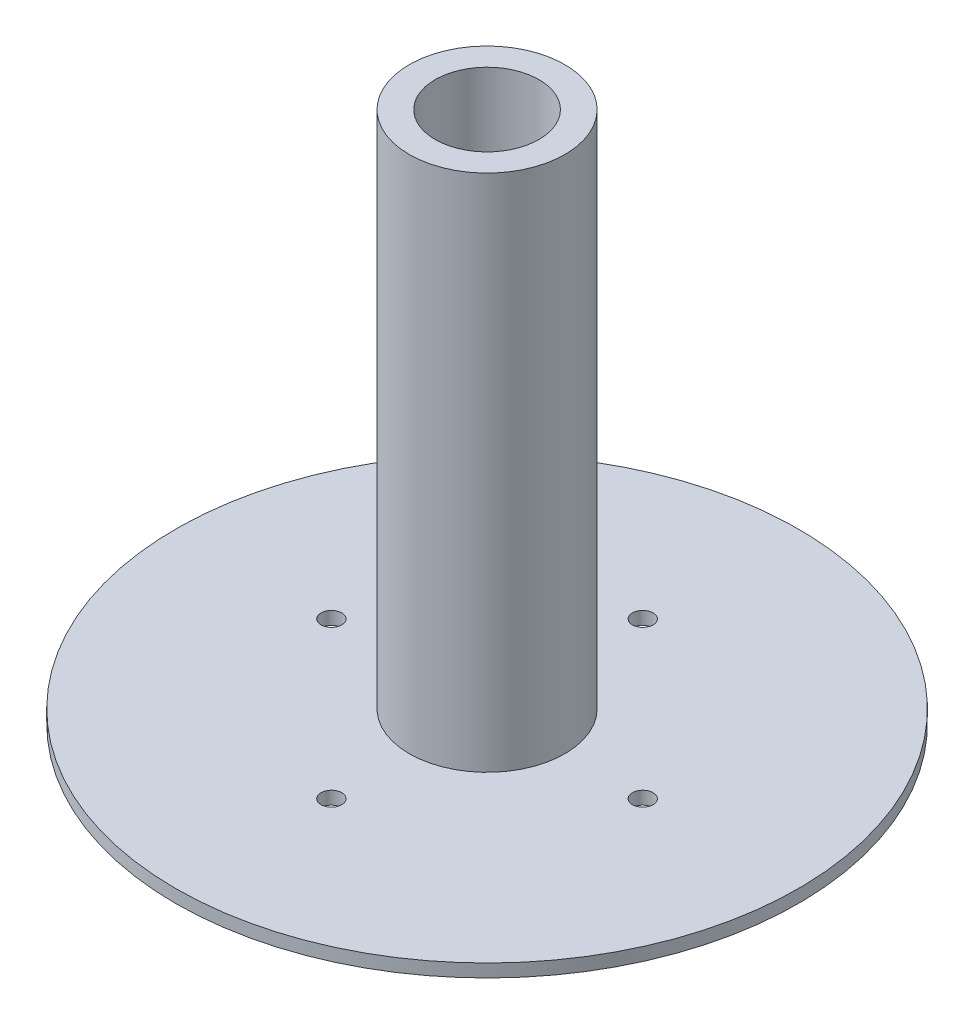
from build123d import *

# Parameters (mm, degrees)
SKETCH_1_R      = 120
EXTRUDE_1_DEPTH = 5
MM_2_D          = 8
MM_2_DEPTH      = 20
MM_2_TIP        = 2.403442476
SKETCH_6_R      = 30
SKETCH_6_R_2    = 20
EXTRUDE_2_DEPTH = 200


with BuildPart() as part:
    # 草图1 → 凸台-拉伸1 (new body)
    with BuildSketch(Plane(origin=(0, 0, 0), x_dir=(1, 0, 0), z_dir=(0, 1, 0))):
        with Locations(Location((0, 0, 0), (0, 0, 270))):
            Circle(SKETCH_1_R)
    extrude(amount=EXTRUDE_1_DEPTH)

    # 大小mm 暗销孔2
    with Locations(Plane(origin=(0, 5, -60), x_dir=(0, 0, 1), z_dir=(0, 1, 0))):
        with Locations((0, 0), (60, -60), (120, 0), (60, 60)):
            Hole(MM_2_D / 2, depth=MM_2_DEPTH)
            with Locations((0, 0, -(MM_2_DEPTH + MM_2_TIP / 2))):  # 118° drill point
                Cone(0, MM_2_D / 2, MM_2_TIP, mode=Mode.SUBTRACT)

    # 草图6 → 凸台-拉伸2 (add)
    with BuildSketch(Plane(origin=(0, 5, 0), x_dir=(1, 0, 0), z_dir=(0, 1, 0))):
        with Locations(Location((0, 0, 0), (0, 0, 270))):
            Circle(SKETCH_6_R)
        with Locations(Location((0, 0, 0), (0, 0, 270))):
            Circle(SKETCH_6_R_2, mode=Mode.SUBTRACT)
    extrude(amount=EXTRUDE_2_DEPTH)


solid = part.part
